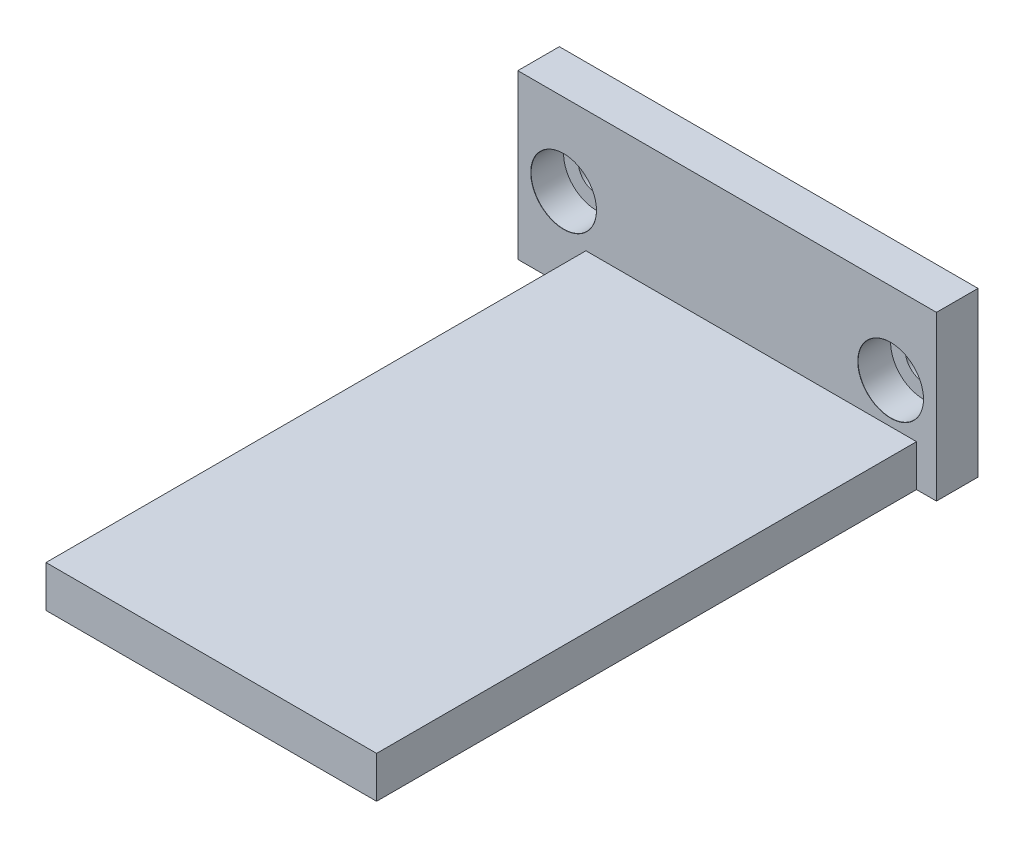
from build123d import *

# Parameters (mm, degrees)
SKETCH1_W                     = 64.008
SKETCH1_H                     = 24.9936
BOSS_EXTRUDE1_DEPTH           = 6.35
SKETCH2_W                     = 64.008
SKETCH2_H                     = 6.35
BOSS_EXTRUDE2_DEPTH           = 82.55
CBORE_FOR_M5_SHCS1_AT_2_COUNT = 2
CBORE_FOR_M5_SHCS1_AT_2_PITCH = 50
SKETCH8_W                     = 10.414
SKETCH8_H                     = 82.55
CUT_EXTRUDE1_DEPTH            = 112.120735621
SKETCH9_W                     = 3.048
SKETCH9_H                     = 82.55
CUT_EXTRUDE3_DEPTH            = 112.120735621


with BuildPart() as part:
    # Sketch1 → Boss-Extrude1 (new body)
    with BuildSketch(Plane.XY):
        with Locations((32.004, 12.4968)):
            Rectangle(SKETCH1_W, SKETCH1_H)
    extrude(amount=BOSS_EXTRUDE1_DEPTH)

    # Sketch2 → Boss-Extrude2 (add)
    with BuildSketch(Plane.XY.offset(6.35)):
        with Locations((32.004, 3.175)):
            Rectangle(SKETCH2_W, SKETCH2_H)
    extrude(amount=BOSS_EXTRUDE2_DEPTH)

    # Sketch7 → CBORE for M5 SHCS1 (revolve, cut)
    with BuildSketch(Plane(origin=(7, 12.5, 6.35), x_dir=(0, -1, 0), z_dir=(1, 0, 0))):
        Polygon((0, 0), (0, 6.35), (2.75, 6.35), (2.75, 5), (5, 5), (5, 0.025), (5.025, 0), align=None)
    cbore_for_m5_shcs1 = revolve(axis=Axis((7, 12.5, 12.7), (0, 0, -1)), mode=Mode.SUBTRACT)

    # CBORE for M5 SHCS1 at 2: CBORE for M5 SHCS1 ×2
    with Locations(*[(i * CBORE_FOR_M5_SHCS1_AT_2_PITCH, 0, 0) for i in range(1, CBORE_FOR_M5_SHCS1_AT_2_COUNT)]):
        add(cbore_for_m5_shcs1, mode=Mode.SUBTRACT)

    # Sketch8 → Cut-Extrude1 (cut, through all)
    with BuildSketch(Plane(origin=(0, 6.35, 0), x_dir=(1, 0, 0), z_dir=(0, 1, 0))):
        with Locations((5.207, -47.625)):
            Rectangle(SKETCH8_W, SKETCH8_H)
    extrude(amount=-CUT_EXTRUDE1_DEPTH, mode=Mode.SUBTRACT)

    # Sketch9 → Cut-Extrude3 (cut, through all)
    with BuildSketch(Plane(origin=(0, 6.35, 0), x_dir=(1, 0, 0), z_dir=(0, 1, 0))):
        with Locations((62.484, -47.625)):
            Rectangle(SKETCH9_W, SKETCH9_H)
    extrude(amount=-CUT_EXTRUDE3_DEPTH, mode=Mode.SUBTRACT)


solid = part.part
